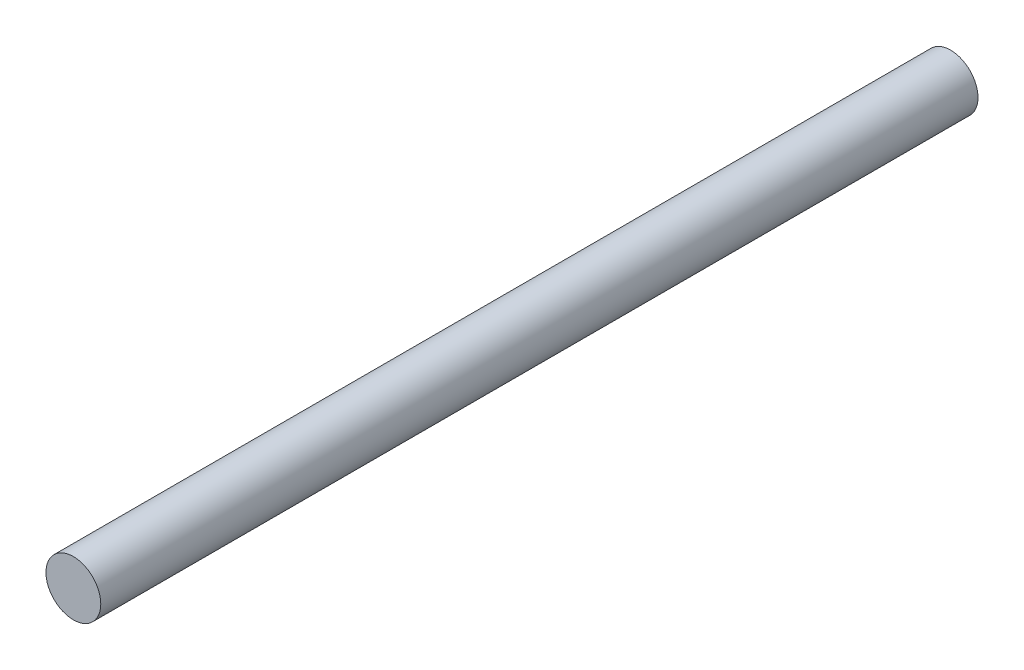
from build123d import *

# Parameters (mm, degrees)
SKETCH1_R           = 0.75
BOSS_EXTRUDE1_DEPTH = 24


with BuildPart() as part:
    # Sketch1 → Boss-Extrude1 (new body)
    with BuildSketch(Plane.XY):
        Circle(SKETCH1_R)
    extrude(amount=BOSS_EXTRUDE1_DEPTH)


solid = part.part
